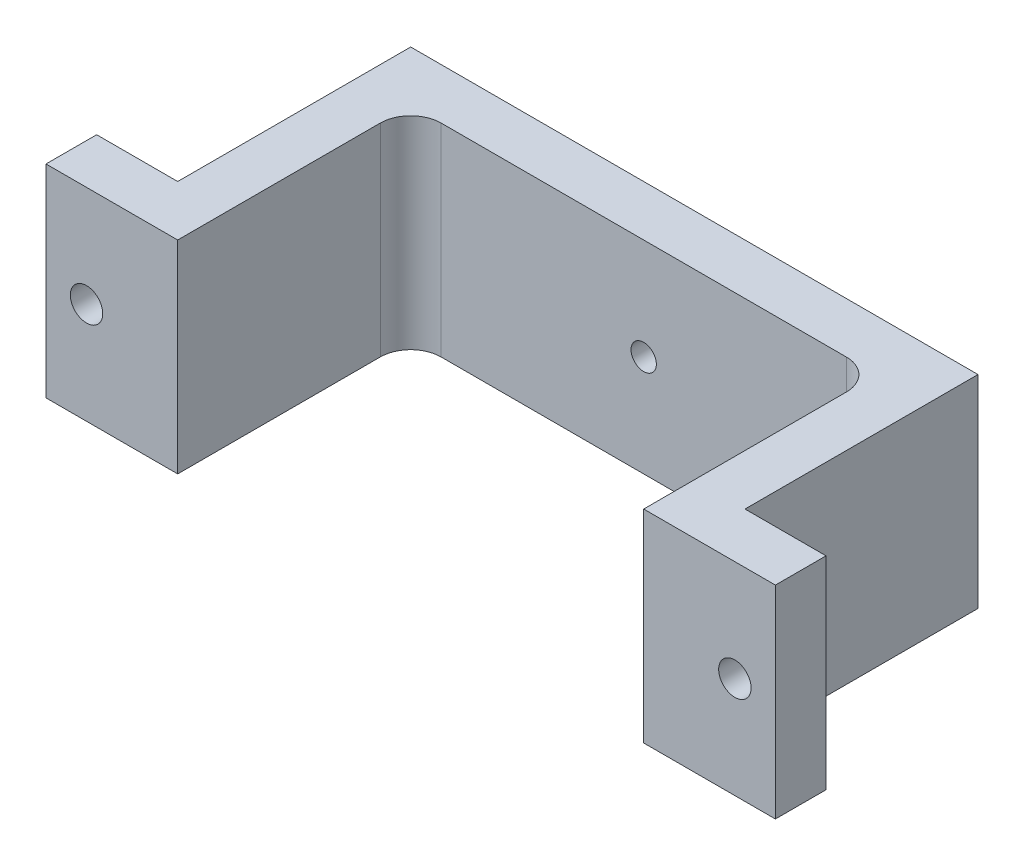
from build123d import *

# Parameters (mm, degrees)
BOSS_EXTRUDE1_DEPTH = 20
FILLET1_R           = 3
CUT_EXTRUDE1_REACH  = 51.8
SKETCH3_R           = 1.6
CUT_EXTRUDE2_REACH  = 51.8
SKETCH4_R           = 1.25


with BuildPart() as part:
    # Sketch1 → Boss-Extrude1 (new body)
    with BuildSketch(Plane(origin=(0, 0, 0), x_dir=(1, 0, 0), z_dir=(0, 1, 0))):
        Polygon((28, 12.528445914), (-28, 12.528445914), (-28, -10.471554086), (-36, -10.471554086), (-36, -15.471554086), (-23, -15.471554086), (-23, 7.528445914), (23, 7.528445914), (23, -15.471554086), (36, -15.471554086), (36, -10.471554086), (28, -10.471554086), align=None)
    extrude(amount=BOSS_EXTRUDE1_DEPTH)

    # Fillet1
    fillet1_edges = [part.edges().sort_by_distance(p)[0] for p in [
        (23, 10, -7.528445914),
        (-23, 10, -7.528445914),
    ]]
    fillet(fillet1_edges, radius=FILLET1_R)

    # Sketch3 → Cut-Extrude1 (cut, up to next)
    with BuildSketch(Plane.XY.offset(15.471554086), mode=Mode.PRIVATE) as cut_extrude1_sk1:
        with Locations((-32, 10)):
            Circle(SKETCH3_R)
    cut_extrude1_tool1 = extrude(cut_extrude1_sk1.sketch, amount=-CUT_EXTRUDE1_REACH, mode=Mode.PRIVATE) & part.part
    # Sketch3 → Cut-Extrude1 (cut, up to next)
    with BuildSketch(Plane.XY.offset(15.471554086), mode=Mode.PRIVATE) as cut_extrude1_sk2:
        with Locations((32, 10)):
            Circle(SKETCH3_R)
    cut_extrude1_tool2 = extrude(cut_extrude1_sk2.sketch, amount=-CUT_EXTRUDE1_REACH, mode=Mode.PRIVATE) & part.part
    add(cut_extrude1_tool1.solids().sort_by_distance((-32, 10, 15.471554))[0], mode=Mode.SUBTRACT)
    add(cut_extrude1_tool2.solids().sort_by_distance((32, 10, 15.471554))[0], mode=Mode.SUBTRACT)

    # Sketch4 → Cut-Extrude2 (cut, up to next)
    with BuildSketch(Plane(origin=(0, 0, -12.528445914), x_dir=(-1, 0, 0), z_dir=(0, 0, -1)), mode=Mode.PRIVATE) as cut_extrude2_sk1:
        with Locations((0, 10)):
            Circle(SKETCH4_R)
    cut_extrude2_tool1 = extrude(cut_extrude2_sk1.sketch, amount=-CUT_EXTRUDE2_REACH, mode=Mode.PRIVATE) & part.part
    add(cut_extrude2_tool1.solids().sort_by_distance((0, 10, -12.528446))[0], mode=Mode.SUBTRACT)


solid = part.part
